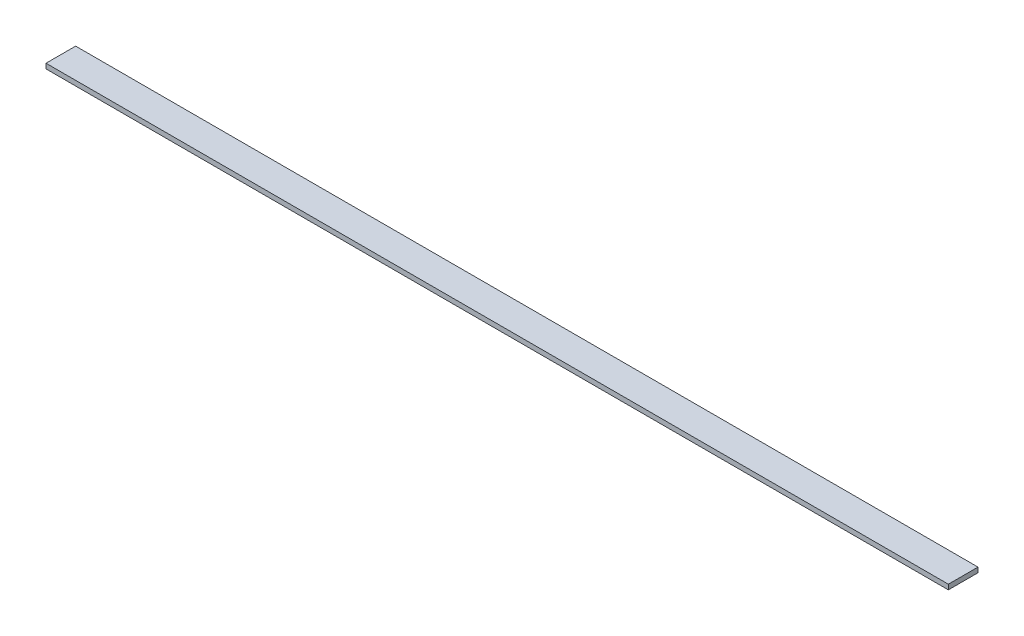
from build123d import *

# Parameters (mm, degrees)
CROQUIS1_W              = 274
CROQUIS1_H              = 9
SALIENTE_EXTRUIR1_DEPTH = 1.5


with BuildPart() as part:
    # Croquis1 → Saliente-Extruir1 (new body)
    with BuildSketch(Plane(origin=(0, 0, 0), x_dir=(1, 0, 0), z_dir=(0, 1, 0))):
        with Locations((137, 4.5)):
            Rectangle(CROQUIS1_W, CROQUIS1_H)
    extrude(amount=SALIENTE_EXTRUIR1_DEPTH)


solid = part.part
